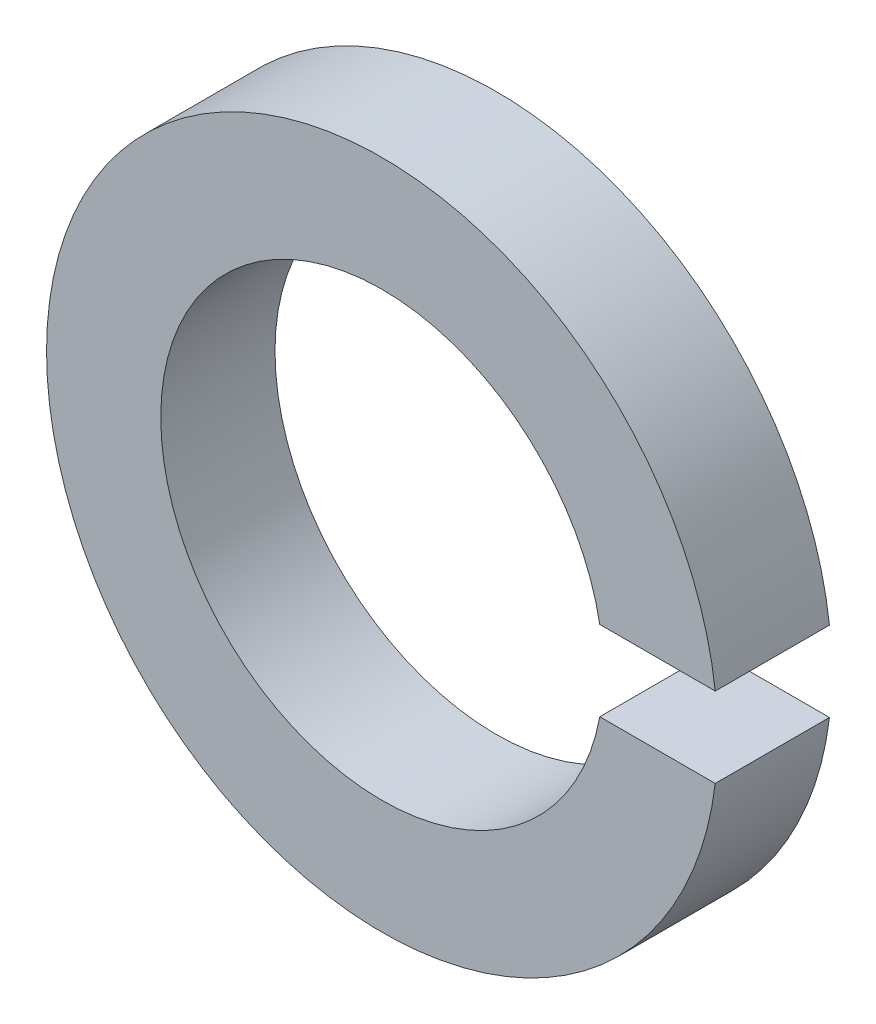
from build123d import *

# Parameters (mm, degrees)
SKETCH_1_R          = 2.35
SKETCH_1_R_2        = 1.55
EXTRUDE_1_DEPTH     = 0.8
SKETCH_2_W          = 0.930969166
SKETCH_2_H          = 0.56
CUT_EXTRUDE_1_DEPTH = 4.418332927


with BuildPart() as part:
    # Эскиз1 → Вытянуть1 (new body)
    with BuildSketch(Plane.XY):
        Circle(SKETCH_1_R)
        Circle(SKETCH_1_R_2, mode=Mode.SUBTRACT)
    extrude(amount=EXTRUDE_1_DEPTH)

    # Эскиз2 → Вырез-Вытянуть1 (cut, through all)
    with BuildSketch(Plane.XY.offset(0.8)):
        with Locations((1.97177665, 0)):
            Rectangle(SKETCH_2_W, SKETCH_2_H)
    extrude(amount=-CUT_EXTRUDE_1_DEPTH, mode=Mode.SUBTRACT)


solid = part.part
